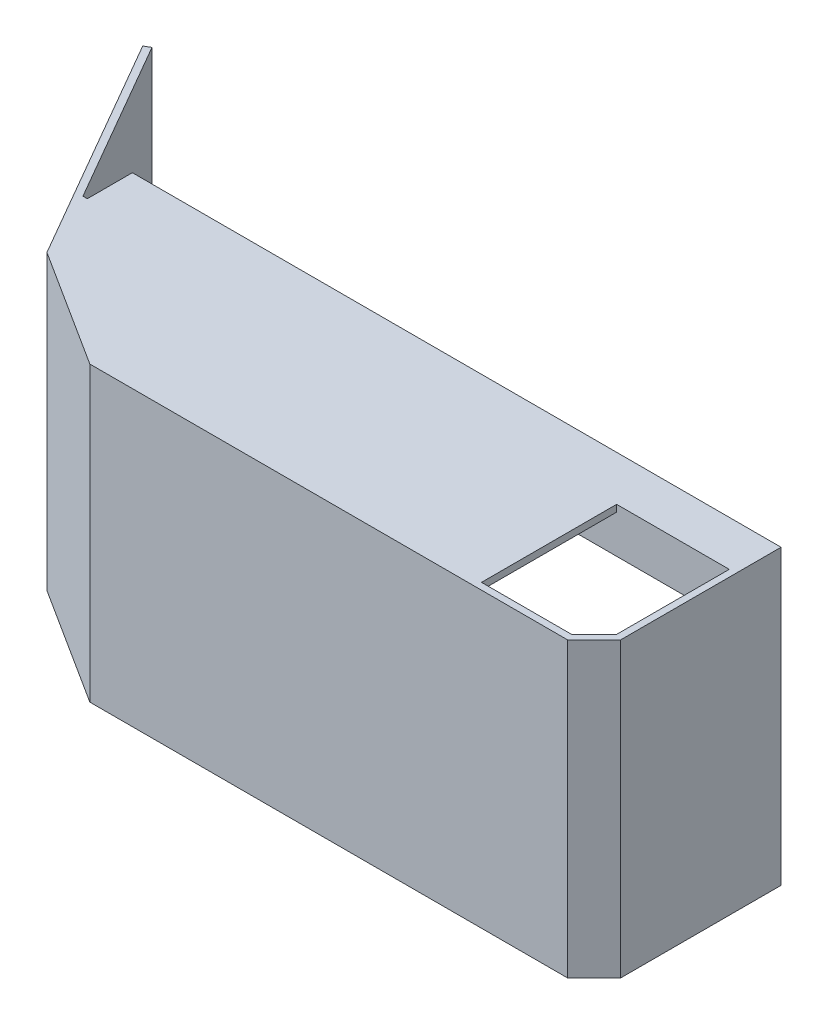
from build123d import *

# Parameters (mm, degrees)
SKETCH1_W           = 285
SKETCH1_H           = 130
SKETCH1_W_2         = 245
SKETCH1_H_2         = 90
BOSS_EXTRUDE1_DEPTH = 20
EXTRUDE_THIN1_DEPTH = 130
BOSS_EXTRUDE2_REACH = 399.778
BOSS_EXTRUDE2_START = 50
SKETCH3_W           = 60
SKETCH3_H           = 3


with BuildPart() as part:
    # Sketch1 → Boss-Extrude1 (new body)
    with BuildSketch(Plane.XY):
        Rectangle(SKETCH1_W, SKETCH1_H)
        Rectangle(SKETCH1_W_2, SKETCH1_H_2, mode=Mode.SUBTRACT)
    extrude(amount=BOSS_EXTRUDE1_DEPTH)

    # Sketch2 → Extrude-Thin1 (add, through all)
    with BuildSketch(Plane(origin=(0, 65, 0), x_dir=(1, 0, 0), z_dir=(0, 1, 0))):
        Polygon((-186.31677691, 52.520571585), (-128.581749991, -47.479428415), (-77.5, -80), (132.5, -80), (142.5, -70), (142.5, 0), (145.5, 0), (145.5, -71.242640687), (133.742640687, -83), (-78.373919532, -83), (-130.812533941, -49.615597272), (-188.914853122, 51.020571585), align=None)
    extrude(amount=-EXTRUDE_THIN1_DEPTH)

    # Sketch3 → Boss-Extrude2 (add, up to next)
    with BuildSketch(Plane.ZY.offset(-142.5).offset(BOSS_EXTRUDE2_START), mode=Mode.PRIVATE) as boss_extrude2_sk1:
        with Locations((50, -63.5)):
            Rectangle(SKETCH3_W, SKETCH3_H)
    boss_extrude2_tool1 = extrude(boss_extrude2_sk1.sketch, amount=BOSS_EXTRUDE2_REACH, mode=Mode.PRIVATE) - part.part
    # Sketch3 → Boss-Extrude2 (add, up to next)
    with BuildSketch(Plane.ZY.offset(-142.5).offset(BOSS_EXTRUDE2_START), mode=Mode.PRIVATE) as boss_extrude2_sk2:
        with Locations((50, 63.5)):
            Rectangle(SKETCH3_W, SKETCH3_H)
    boss_extrude2_tool2 = extrude(boss_extrude2_sk2.sketch, amount=BOSS_EXTRUDE2_REACH, mode=Mode.PRIVATE) - part.part
    add(boss_extrude2_tool1.solids().sort_by_distance((92.5, -63.5, 50))[0])
    add(boss_extrude2_tool2.solids().sort_by_distance((92.5, 63.5, 50))[0])


solid = part.part
